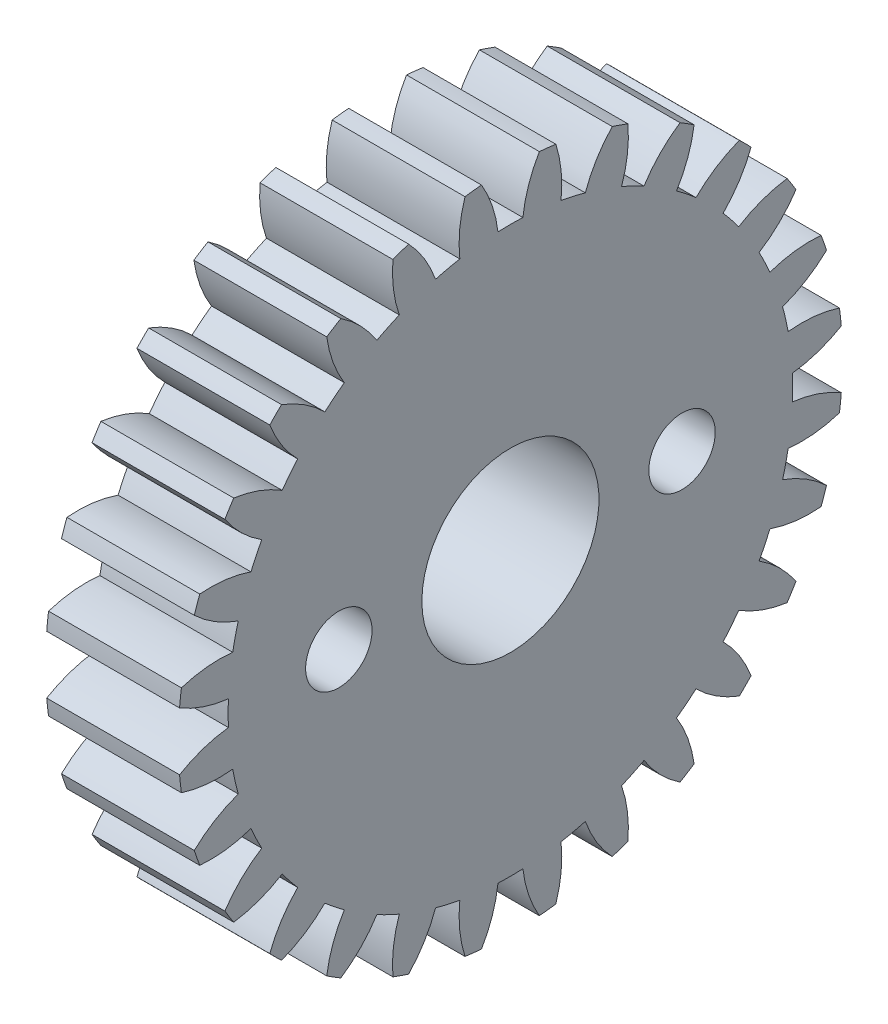
from build123d import *

# Parameters (mm, degrees)
BASPROSKE_W           = 6
BASPROSKE_H           = 15
TOOTHCUT_DEPTH        = 23.045407685
TEETHCUTS_COUNT       = 28
TEETHCUTS_ANGLE       = 347.142857143
BORSKE_R              = 4
BORE_DEPTH            = 50.0000508
CROQUIS1_R            = 1.5
CORTAR_EXTRUIR1_DEPTH = 10


with BuildPart() as part:
    # BasProSke → Base-Revolve (revolve)
    with BuildSketch(Plane(origin=(0, 0, 0), x_dir=(1, 0, 0), z_dir=(0, 1, 0)), mode=Mode.PRIVATE) as base_revolve_sk:
        with Locations((3, 7.5)):
            Rectangle(BASPROSKE_W, BASPROSKE_H)
    revolve(base_revolve_sk.sketch.rotate(Axis((-10, 0, 0), (1, 0, 0)), 180), axis=Axis((-10, 0, 0), (1, 0, 0)))

    # TooCutSke → ToothCut (cut, through all)
    with BuildSketch(Plane(origin=(0, 0, 0), x_dir=(0, 0, -1), z_dir=(1, 0, 0))):
        with BuildLine():
            ThreePointArc((0.562705027, 12.736575837), (0, 12.749), (-0.562705027, 12.736575837))
            ThreePointArc((-0.562705027, 12.736575837), (-0.822951015, 13.892219122), (-1.32045988, 14.96726531))
            ThreePointArc((-1.32045988, 14.96726531), (0, 15.0254), (1.32045988, 14.96726531))
            ThreePointArc((1.32045988, 14.96726531), (0.822951015, 13.892219122), (0.562705027, 12.736575837))
        make_face()
    toothcut = extrude(amount=TOOTHCUT_DEPTH, mode=Mode.SUBTRACT)

    # TeethCuts: ToothCut ×28 about axis
    teethcuts_axis = Axis((-10, 0, 0), (1, 0, 0))
    for i in range(1, TEETHCUTS_COUNT):
        add(toothcut.rotate(teethcuts_axis, i * TEETHCUTS_ANGLE / (TEETHCUTS_COUNT - 1)), mode=Mode.SUBTRACT)

    # BorSke → Bore (cut, symmetric)
    with BuildSketch(Plane(origin=(0, 0, 0), x_dir=(0, 0, -1), z_dir=(1, 0, 0))):
        with Locations(Location((0, 0, 0), (0, 0, 180))):
            Circle(BORSKE_R)
    extrude(amount=BORE_DEPTH, both=True, mode=Mode.SUBTRACT)

    # Croquis1 → Cortar-Extruir1 (cut)
    with BuildSketch(Plane(origin=(6, 0, 0), x_dir=(0, 0, -1), z_dir=(1, 0, 0))):
        with Locations((-7.75, 0)):
            Circle(CROQUIS1_R)
        with Locations((7.75, 0)):
            Circle(CROQUIS1_R)
    extrude(amount=-CORTAR_EXTRUIR1_DEPTH, mode=Mode.SUBTRACT)


solid = part.part
